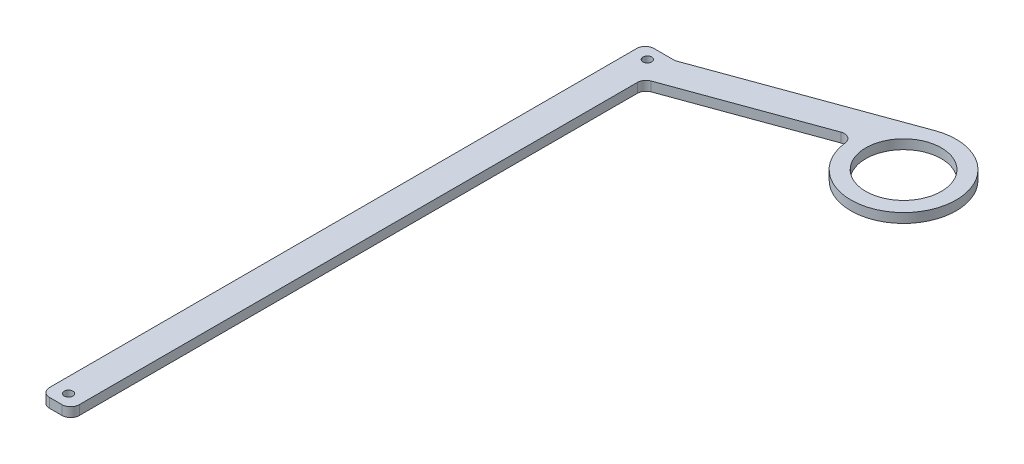
from build123d import *

# Parameters (mm, degrees)
SKETCH1_R           = 1.4605
SKETCH1_R_2         = 12.7
BOSS_EXTRUDE1_DEPTH = 3.175
FILLET1_R           = 2.921


with BuildPart() as part:
    # Sketch1 → Boss-Extrude1 (new body)
    with BuildSketch(Plane(origin=(0, 0, 0), x_dir=(1, 0, 0), z_dir=(0, 1, 0))):
        with BuildLine():
            Line((5, -101.6), (5, 90.958222275))
            Line((5, 90.958222275), (57.514533832, 110.071949456))
            ThreePointArc((57.514533832, 110.071949456), (89.092337947, 97.415945766), (69.070568383, 124.919779784))
            Line((69.070568383, 124.919779784), (5, 101.6))
            Line((5, 101.6), (-5, 101.6))
            Line((-5, 101.6), (-5, -101.6))
            Line((-5, -101.6), (5, -101.6))
        make_face()
        with Locations(Location((0, -97.28, 0), (0, 0, 270))):
            Circle(SKETCH1_R, mode=Mode.SUBTRACT)
        with Locations(Location((0, 97.28, 0), (0, 0, 270))):
            Circle(SKETCH1_R, mode=Mode.SUBTRACT)
        with Locations(Location((75.12432492, 108.287220396, 0), (0, 0, 270))):
            Circle(SKETCH1_R_2, mode=Mode.SUBTRACT)
    extrude(amount=BOSS_EXTRUDE1_DEPTH)

    # Fillet1
    fillet1_edges = [part.edges().sort_by_distance(p)[0] for p in [
        (-5, 1.5875, 101.6),
        (-5, 1.5875, -101.6),
        (5, 1.5875, -101.6),
        (57.514533832, 1.5875, -110.071949456),
        (5, 1.5875, -90.958222275),
        (5, 1.5875, 101.6),
    ]]
    fillet(fillet1_edges, radius=FILLET1_R)


solid = part.part
